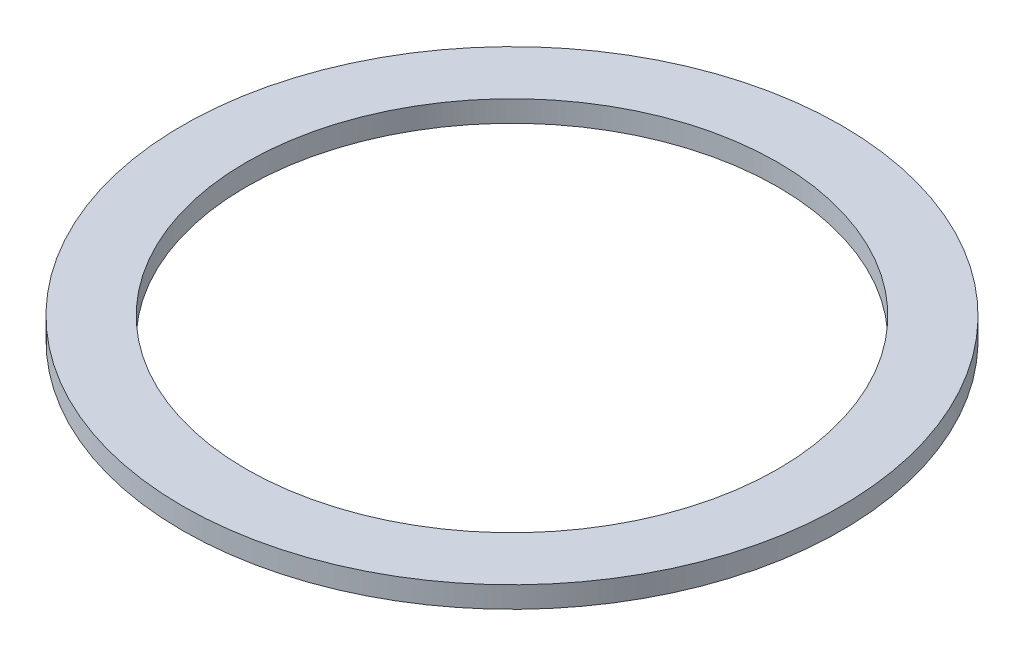
from build123d import *

# Parameters (mm, degrees)
SKETCH1_R           = 31
SKETCH1_R_2         = 25
BOSS_EXTRUDE1_DEPTH = 2


with BuildPart() as part:
    # Sketch1 → Boss-Extrude1 (new body)
    with BuildSketch(Plane(origin=(0, 0, 0), x_dir=(1, 0, 0), z_dir=(0, 1, 0))):
        with Locations(Location((0, 0, 0), (0, 0, 270))):
            Circle(SKETCH1_R)
        with Locations(Location((0, 0, 0), (0, 0, 270))):
            Circle(SKETCH1_R_2, mode=Mode.SUBTRACT)
    extrude(amount=BOSS_EXTRUDE1_DEPTH)


solid = part.part
